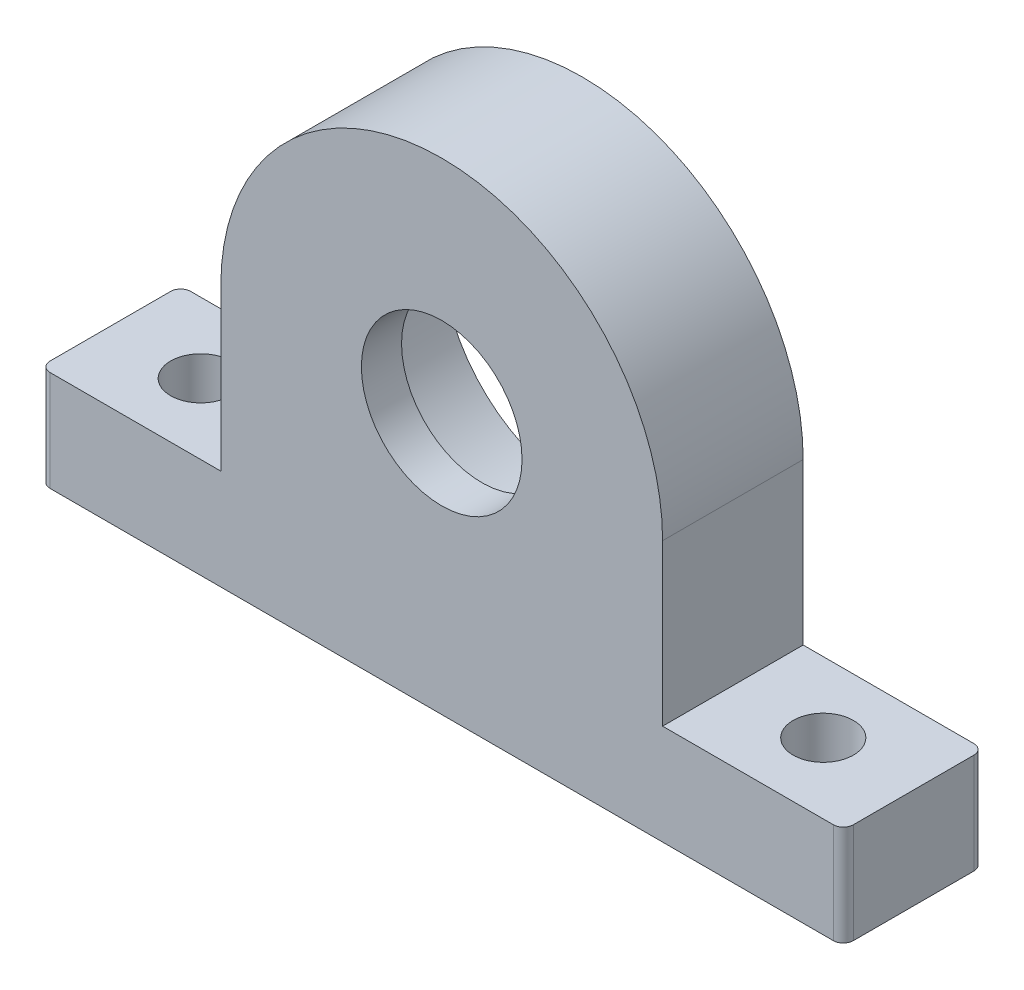
from build123d import *

# Parameters (mm, degrees)
BOSS_EXTRUDE1_DEPTH = 7
SKETCH2_R           = 7
CUT_EXTRUDE1_DEPTH  = 5
SKETCH3_R           = 1.5
CUT_EXTRUDE2_DEPTH  = 5
FILLET1_R           = 0.5


with BuildPart() as part:
    # Sketch1 → Boss-Extrude1 (new body)
    with BuildSketch(Plane.XY):
        with BuildLine():
            ThreePointArc((0, 11), (-7.778174593, 7.778174593), (-11, 0))
            ThreePointArc((-11, 0), (-7.778174593, -7.778174593), (0, -11))
            Line((0, -11), (0, -4))
            ThreePointArc((0, -4), (-4, 0), (0, 4))
            Line((0, 4), (0, 11))
        make_face()
        with BuildLine():
            ThreePointArc((11, 0), (7.778174593, 7.778174593), (0, 11))
            Line((0, 11), (0, 4))
            ThreePointArc((0, 4), (2.828427125, 2.828427125), (4, 0))
            ThreePointArc((4, 0), (2.828427125, -2.828427125), (0, -4))
            Line((0, -4), (0, -11))
            ThreePointArc((0, -11), (7.778174593, -7.778174593), (11, 0))
        make_face()
        with BuildLine():
            ThreePointArc((0, -11), (-7.778174593, -7.778174593), (-11, 0))
            Line((-11, 0), (-11, -8))
            Line((-11, -8), (-20, -8))
            Line((-20, -8), (-20, -13))
            Line((-20, -13), (0, -13))
            Line((0, -13), (0, -11))
        make_face()
        with BuildLine():
            ThreePointArc((11, 0), (7.778174593, -7.778174593), (0, -11))
            Line((0, -11), (0, -13))
            Line((0, -13), (20, -13))
            Line((20, -13), (20, -8))
            Line((20, -8), (11, -8))
            Line((11, -8), (11, 0))
        make_face()
    extrude(amount=BOSS_EXTRUDE1_DEPTH)

    # Sketch2 → Cut-Extrude1 (cut)
    with BuildSketch(Plane(origin=(0, 0, 0), x_dir=(-1, 0, 0), z_dir=(0, 0, -1))):
        Circle(SKETCH2_R)
    extrude(amount=-CUT_EXTRUDE1_DEPTH, mode=Mode.SUBTRACT)

    # Sketch3 → Cut-Extrude2 (cut)
    with BuildSketch(Plane(origin=(0, -8, 0), x_dir=(1, 0, 0), z_dir=(0, 1, 0))):
        with Locations(Location((-15.5, -3.5, 0), (0, 0, 270))):
            Circle(SKETCH3_R)
        with Locations(Location((15.5, -3.5, 0), (0, 0, 90))):
            Circle(SKETCH3_R)
    extrude(amount=-CUT_EXTRUDE2_DEPTH, mode=Mode.SUBTRACT)

    # Fillet1
    fillet1_edges = [part.edges().sort_by_distance(p)[0] for p in [
        (20, -10.5, 7),
        (-20, -10.5, 0),
        (20, -10.5, 0),
        (-20, -10.5, 7),
    ]]
    fillet(fillet1_edges, radius=FILLET1_R)


solid = part.part
